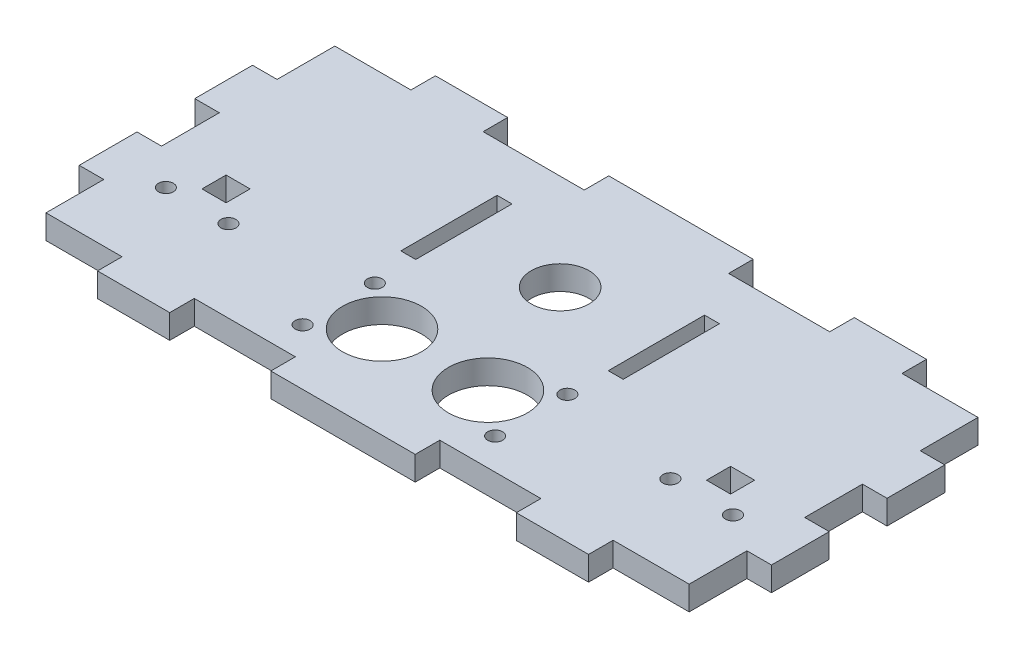
from build123d import *

# Parameters (mm, degrees)
SKETCH1_R           = 8.2
SKETCH1_R_2         = 6
SKETCH1_R_3         = 1.55
SKETCH1_W           = 3.1
SKETCH1_H           = 20
SKETCH1_W_2         = 5
SKETCH1_H_2         = 5
BOSS_EXTRUDE1_DEPTH = 5


with BuildPart() as part:
    # Sketch1 → Boss-Extrude1 (new body)
    with BuildSketch(Plane(origin=(0, 0, 0), x_dir=(1, 0, 0), z_dir=(0, 1, 0))):
        Polygon((-81.8, -30), (-66, -30), (-66, -35.1), (-51, -35.1), (-51, -30), (-30, -30), (-30, -35.1), (0, -35.1), (0, -30), (21, -30), (21, -35.1), (36, -35.1), (36, -30), (51.8, -30), (51.8, -18), (56.9, -18), (56.9, -6), (51.8, -6), (51.8, 6), (56.9, 6), (56.9, 18), (51.8, 18), (51.8, 30), (36, 30), (36, 35.1), (21, 35.1), (21, 30), (0, 30), (0, 35.1), (-30, 35.1), (-30, 30), (-51, 30), (-51, 35.1), (-66, 35.1), (-66, 30), (-81.8, 30), (-81.8, 18), (-86.9, 18), (-86.9, 6), (-81.8, 6), (-81.8, -6), (-86.9, -6), (-86.9, -18), (-81.8, -18), align=None)
        with Locations(Location((-4, -16, 0), (0, 0, 270))):
            Circle(SKETCH1_R, mode=Mode.SUBTRACT)
        with Locations(Location((-26, -16, 0), (0, 0, 270))):
            Circle(SKETCH1_R, mode=Mode.SUBTRACT)
        with Locations(Location((-15, 10, 0), (0, 0, 270))):
            Circle(SKETCH1_R_2, mode=Mode.SUBTRACT)
        with Locations(Location((5, -8.5, 0), (0, 0, 270))):
            Circle(SKETCH1_R_3, mode=Mode.SUBTRACT)
        with Locations(Location((5, -23.5, 0), (0, 0, 270))):
            Circle(SKETCH1_R_3, mode=Mode.SUBTRACT)
        with Locations(Location((-35, -8.5, 0), (0, 0, 270))):
            Circle(SKETCH1_R_3, mode=Mode.SUBTRACT)
        with Locations(Location((-35, -23.5, 0), (0, 0, 270))):
            Circle(SKETCH1_R_3, mode=Mode.SUBTRACT)
        with Locations(Location((-73.9, -13, 0), (0, 0, 270))):
            Circle(SKETCH1_R_3, mode=Mode.SUBTRACT)
        with Locations(Location((-60.9, -13, 0), (0, 0, 270))):
            Circle(SKETCH1_R_3, mode=Mode.SUBTRACT)
        with Locations(Location((30.9, -13, 0), (0, 0, 90))):
            Circle(SKETCH1_R_3, mode=Mode.SUBTRACT)
        with Locations(Location((43.9, -13, 0), (0, 0, 90))):
            Circle(SKETCH1_R_3, mode=Mode.SUBTRACT)
        with Locations((6.55, 10)):
            Rectangle(SKETCH1_W, SKETCH1_H, mode=Mode.SUBTRACT)
        with Locations((-36.55, 10)):
            Rectangle(SKETCH1_W, SKETCH1_H, mode=Mode.SUBTRACT)
        with Locations((-67.4, -7)):
            Rectangle(SKETCH1_W_2, SKETCH1_H_2, mode=Mode.SUBTRACT)
        with Locations((37.4, -7)):
            Rectangle(SKETCH1_W_2, SKETCH1_H_2, mode=Mode.SUBTRACT)
    extrude(amount=BOSS_EXTRUDE1_DEPTH)


solid = part.part
